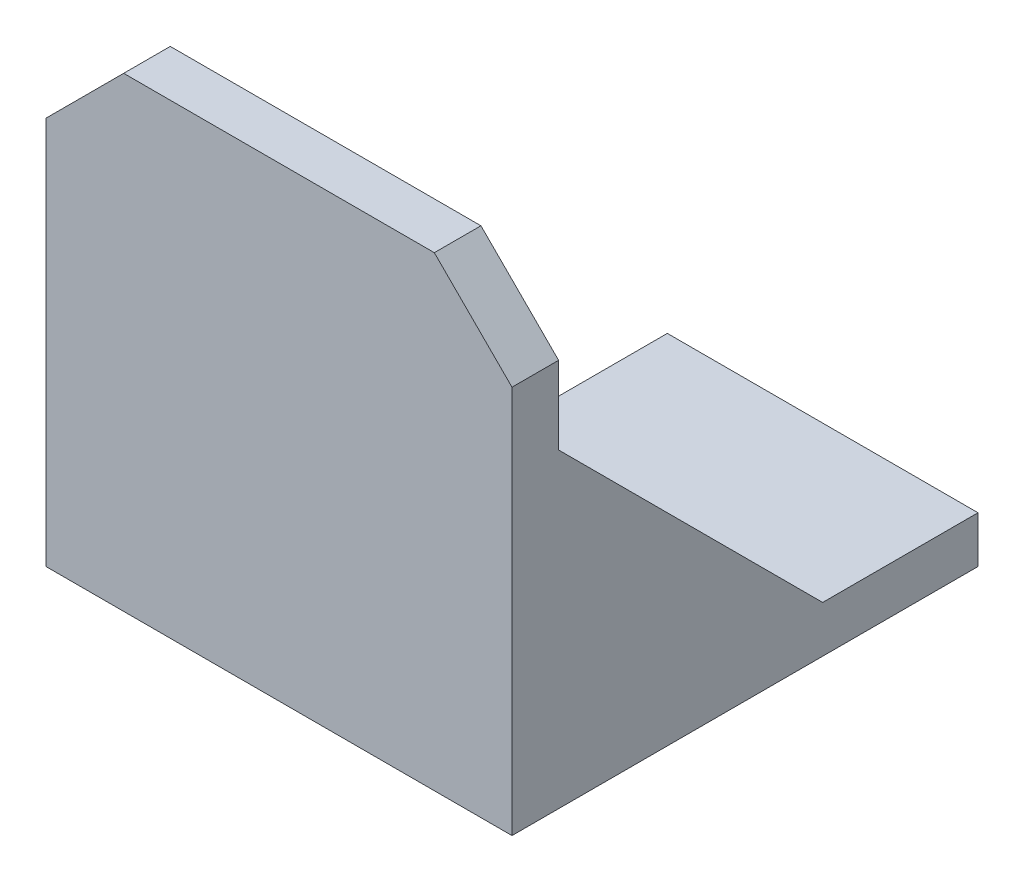
from build123d import *

# Parameters (mm, degrees)
BOSS_EXTRUDE1_DEPTH = 3
SKETCH2_W           = 30
SKETCH2_H           = 3
BOSS_EXTRUDE2_DEPTH = 27
BOSS_EXTRUDE3_DEPTH = 2
BOSS_EXTRUDE4_DEPTH = 2
CHAMFER1_SIZE       = 5
FILLET1_R           = 3


with BuildPart() as part:
    # Sketch1 → Boss-Extrude1 (new body)
    with BuildSketch(Plane(origin=(0, 0, 0), x_dir=(1, 0, 0), z_dir=(0, 1, 0))):
        Polygon((-5, 15), (15, 15), (15, -15), (-15, -15), (-15, 5), (-5, 5), align=None)
    extrude(amount=BOSS_EXTRUDE1_DEPTH)

    # Sketch2 → Boss-Extrude2 (add)
    with BuildSketch(Plane(origin=(0, 3, 0), x_dir=(1, 0, 0), z_dir=(0, 1, 0))):
        with Locations((0, -13.5)):
            Rectangle(SKETCH2_W, SKETCH2_H)
    extrude(amount=BOSS_EXTRUDE2_DEPTH)

    # Sketch3 → Boss-Extrude3 (add)
    with BuildSketch(Plane.ZY.offset(15)):
        Polygon((-5, 3), (12, 20), (12, 3), align=None)
    extrude(amount=-BOSS_EXTRUDE3_DEPTH)

    # Sketch4 → Boss-Extrude4 (add)
    with BuildSketch(Plane(origin=(15, 0, 0), x_dir=(0, 0, -1), z_dir=(1, 0, 0))):
        Polygon((-12, 20), (5, 3), (-12, 3), align=None)
    extrude(amount=-BOSS_EXTRUDE4_DEPTH)

    # Chamfer1
    chamfer1_edges = [part.edges().sort_by_distance(p)[0] for p in [
        (-15, 30, 13.5),
        (15, 30, 13.5),
    ]]
    chamfer(chamfer1_edges, length=CHAMFER1_SIZE)

    # Fillet1
    fillet1_edges = [part.edges().sort_by_distance(p)[0] for p in [
        (0, 3, 12),
    ]]
    fillet(fillet1_edges, radius=FILLET1_R)


solid = part.part
